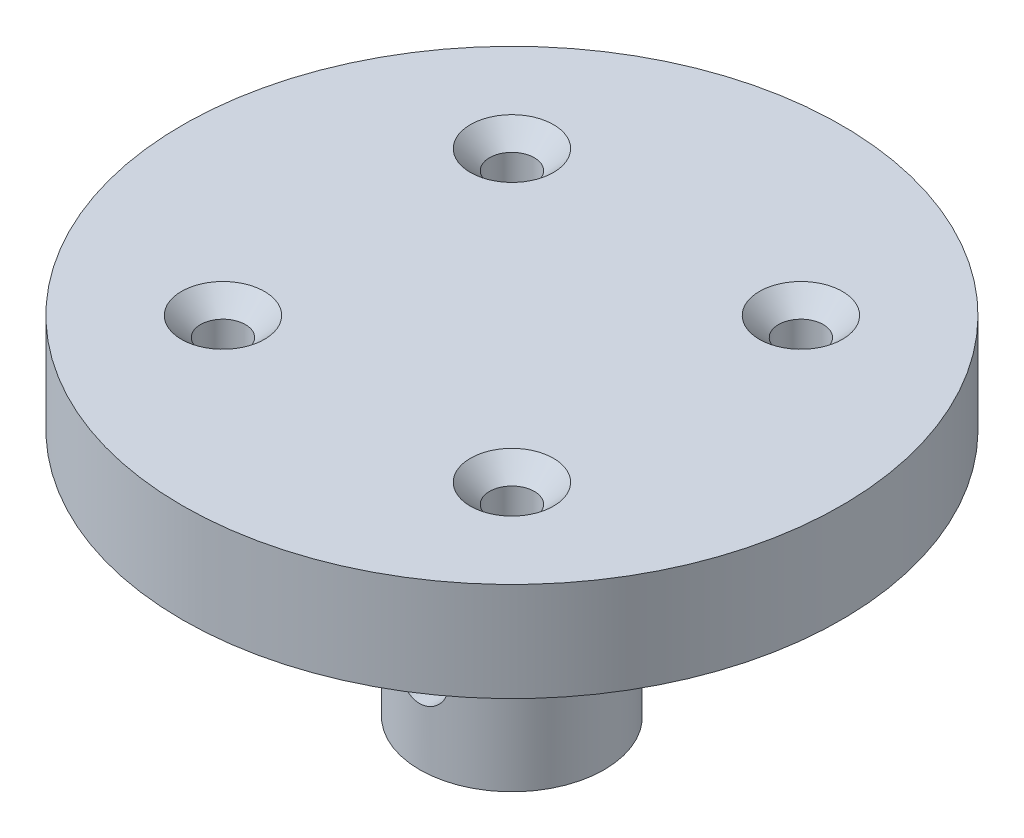
from build123d import *

# Parameters (mm, degrees)
SKETCH1_R                                      = 25
BOSS_EXTRUDE1_DEPTH                            = 7.5
CSK_FOR_M3_FLAT_HEAD_MACHINE_SCREW1_AT_2_COUNT = 2
CSK_FOR_M3_FLAT_HEAD_MACHINE_SCREW1_AT_2_PITCH = 21.920310217
CSK_FOR_M3_FLAT_HEAD_MACHINE_SCREW1_AT_3_COUNT = 2
CSK_FOR_M3_FLAT_HEAD_MACHINE_SCREW1_AT_3_PITCH = 31
CSK_FOR_M3_FLAT_HEAD_MACHINE_SCREW1_AT_4_COUNT = 2
CSK_FOR_M3_FLAT_HEAD_MACHINE_SCREW1_AT_4_PITCH = 21.920310217
SKETCH6_R                                      = 7
BOSS_EXTRUDE2_DEPTH                            = 18.85
SKETCH7_R                                      = 1
CUT_EXTRUDE1_DEPTH                             = 10.5
SKETCH11_R                                     = 1.9
CUT_EXTRUDE2_DEPTH                             = 2


with BuildPart() as part:
    # Sketch1 → Boss-Extrude1 (new body)
    with BuildSketch(Plane(origin=(0, 0, 0), x_dir=(1, 0, 0), z_dir=(0, 1, 0))):
        with Locations(Location((0, 0, 0), (0, 0, 270))):
            Circle(SKETCH1_R)
    extrude(amount=BOSS_EXTRUDE1_DEPTH)

    # Sketch5 → CSK for M3 Flat Head Machine Screw1 (revolve, cut)
    with BuildSketch(Plane(origin=(-10.960155108, 7.5, -10.960155108), x_dir=(0, 0, 1), z_dir=(1, 0, 0))):
        Polygon((0, 0), (0, 7.5), (1.725, 7.5), (1.7, 7.475), (1.7, 1.45), (3.15, 0), align=None)
    csk_for_m3_flat_head_machine_screw1 = revolve(axis=Axis((-10.960155108, 13.85, -10.960155108), (0, -1, 0)), mode=Mode.SUBTRACT)

    # CSK for M3 Flat Head Machine Screw1 at 2: CSK for M3 Flat Head Machine Screw1 ×2
    with Locations(*[(i * CSK_FOR_M3_FLAT_HEAD_MACHINE_SCREW1_AT_2_PITCH, 0, 0) for i in range(1, CSK_FOR_M3_FLAT_HEAD_MACHINE_SCREW1_AT_2_COUNT)]):
        add(csk_for_m3_flat_head_machine_screw1, mode=Mode.SUBTRACT)

    # CSK for M3 Flat Head Machine Screw1 at 3: CSK for M3 Flat Head Machine Screw1 ×2
    with Locations(*[Vector(0.7071067811865475, 0, 0.7071067811865476) * (i * CSK_FOR_M3_FLAT_HEAD_MACHINE_SCREW1_AT_3_PITCH) for i in range(1, CSK_FOR_M3_FLAT_HEAD_MACHINE_SCREW1_AT_3_COUNT)]):
        add(csk_for_m3_flat_head_machine_screw1, mode=Mode.SUBTRACT)

    # CSK for M3 Flat Head Machine Screw1 at 4: CSK for M3 Flat Head Machine Screw1 ×2
    with Locations(*[(0, 0, i * CSK_FOR_M3_FLAT_HEAD_MACHINE_SCREW1_AT_4_PITCH) for i in range(1, CSK_FOR_M3_FLAT_HEAD_MACHINE_SCREW1_AT_4_COUNT)]):
        add(csk_for_m3_flat_head_machine_screw1, mode=Mode.SUBTRACT)

    # Sketch6 → Boss-Extrude2 (add)
    with BuildSketch(Plane.XZ):
        with Locations(Location((0, 0, 0), (0, 0, 90))):
            Circle(SKETCH6_R)
        with BuildLine():
            Line((-2.645751311, 3), (2.645751311, 3))
            ThreePointArc((2.645751311, 3), (0, -4), (-2.645751311, 3))
        make_face(mode=Mode.SUBTRACT)
    extrude(amount=BOSS_EXTRUDE2_DEPTH)

    # Sketch7 → Cut-Extrude1 (cut)
    with BuildSketch(Plane.XY):
        with Locations(Location((0, -12.6, 0), (0, 0, 180))):
            Circle(SKETCH7_R)
    extrude(amount=CUT_EXTRUDE1_DEPTH, mode=Mode.SUBTRACT)

    # Sketch11 → Cut-Extrude2 (cut)
    with BuildSketch(Plane.XY.offset(7)):
        with Locations((0, -12.6)):
            Circle(SKETCH11_R)
    extrude(amount=-CUT_EXTRUDE2_DEPTH, mode=Mode.SUBTRACT)


solid = part.part
